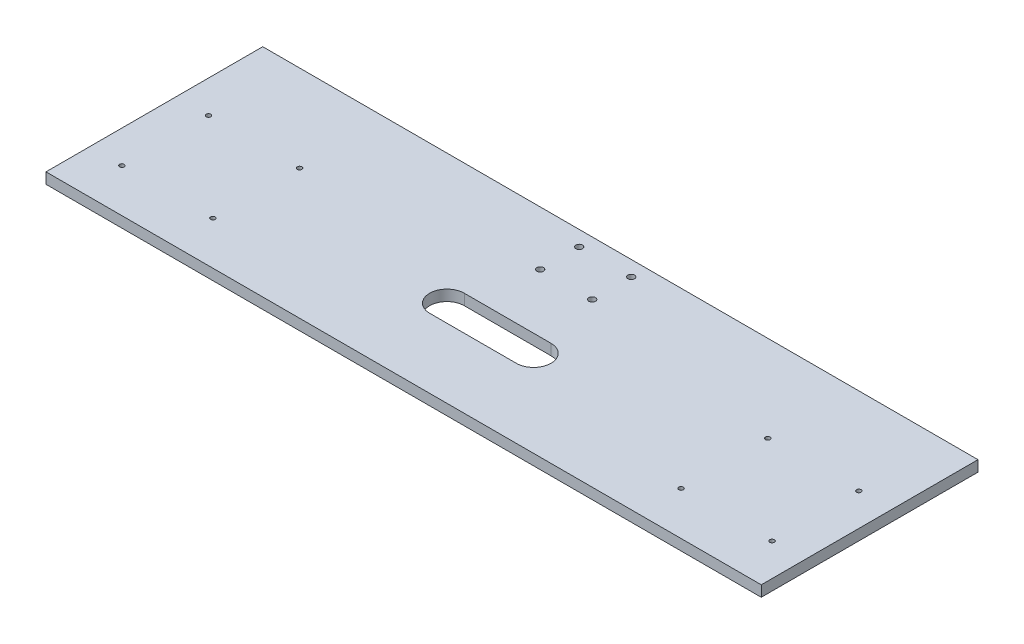
from build123d import *

# Parameters (mm, degrees)
SKETCH_1_W          = 330
SKETCH_1_H          = 100
EXTRUDE_1_DEPTH     = 5
SKETCH_3_R          = 1.515
CUT_EXTRUDE_1_DEPTH = 259.310540517
SKETCH_4_R          = 1.05
CUT_EXTRUDE_2_DEPTH = 259.310540517


with BuildPart() as part:
    # 草图1 → 凸台-拉伸1 (new body)
    with BuildSketch(Plane(origin=(0, 0, 0), x_dir=(1, 0, 0), z_dir=(0, 1, 0))):
        with Locations((9.630350195, -140.272373541)):
            Rectangle(SKETCH_1_W, SKETCH_1_H)
    extrude(amount=EXTRUDE_1_DEPTH)

    # 草图3 → 切除-拉伸1 (cut, through all)
    with BuildSketch(Plane(origin=(0, 5, 0), x_dir=(1, 0, 0), z_dir=(0, 1, 0))):
        with Locations(Location((-2.369649805, -97.272373541, 0), (0, 0, 270))):
            Circle(SKETCH_3_R)
        with Locations(Location((21.630350195, -97.272373541, 0), (0, 0, 90))):
            Circle(SKETCH_3_R)
        with Locations(Location((-2.369649805, -115.272373541, 0), (0, 0, 270))):
            Circle(SKETCH_3_R)
        with Locations(Location((21.630350195, -115.272373541, 0), (0, 0, 90))):
            Circle(SKETCH_3_R)
    extrude(amount=-CUT_EXTRUDE_1_DEPTH, mode=Mode.SUBTRACT)

    # 草图4 → 切除-拉伸2 (cut, through all)
    with BuildSketch(Plane(origin=(0, 5, 0), x_dir=(1, 0, 0), z_dir=(0, 1, 0))):
        with Locations(Location((-140.369649805, -170.272373541, 0), (0, 0, 270))):
            Circle(SKETCH_4_R)
        with Locations(Location((-140.369649805, -130.272373541, 0), (0, 0, 90))):
            Circle(SKETCH_4_R)
        with Locations(Location((-98.369649805, -170.272373541, 0), (0, 0, 270))):
            Circle(SKETCH_4_R)
        with Locations(Location((-98.369649805, -130.272373541, 0), (0, 0, 90))):
            Circle(SKETCH_4_R)
        with Locations(Location((117.630350195, -130.272373541, 0), (0, 0, 270))):
            Circle(SKETCH_4_R)
        with Locations(Location((117.630350195, -170.272373541, 0), (0, 0, 90))):
            Circle(SKETCH_4_R)
        with Locations(Location((159.630350195, -130.272373541, 0), (0, 0, 270))):
            Circle(SKETCH_4_R)
        with Locations(Location((159.630350195, -170.272373541, 0), (0, 0, 90))):
            Circle(SKETCH_4_R)
        with BuildLine():
            Line((-10.369649805, -142.272373541), (29.630350195, -142.272373541))
            ThreePointArc((29.630350195, -142.272373541), (37.630350195, -150.272373541), (29.630350195, -158.272373541))
            Line((29.630350195, -158.272373541), (-10.369649805, -158.272373541))
            ThreePointArc((-10.369649805, -158.272373541), (-18.369649805, -150.272373541), (-10.369649805, -142.272373541))
        make_face()
    extrude(amount=-CUT_EXTRUDE_2_DEPTH, mode=Mode.SUBTRACT)


solid = part.part
